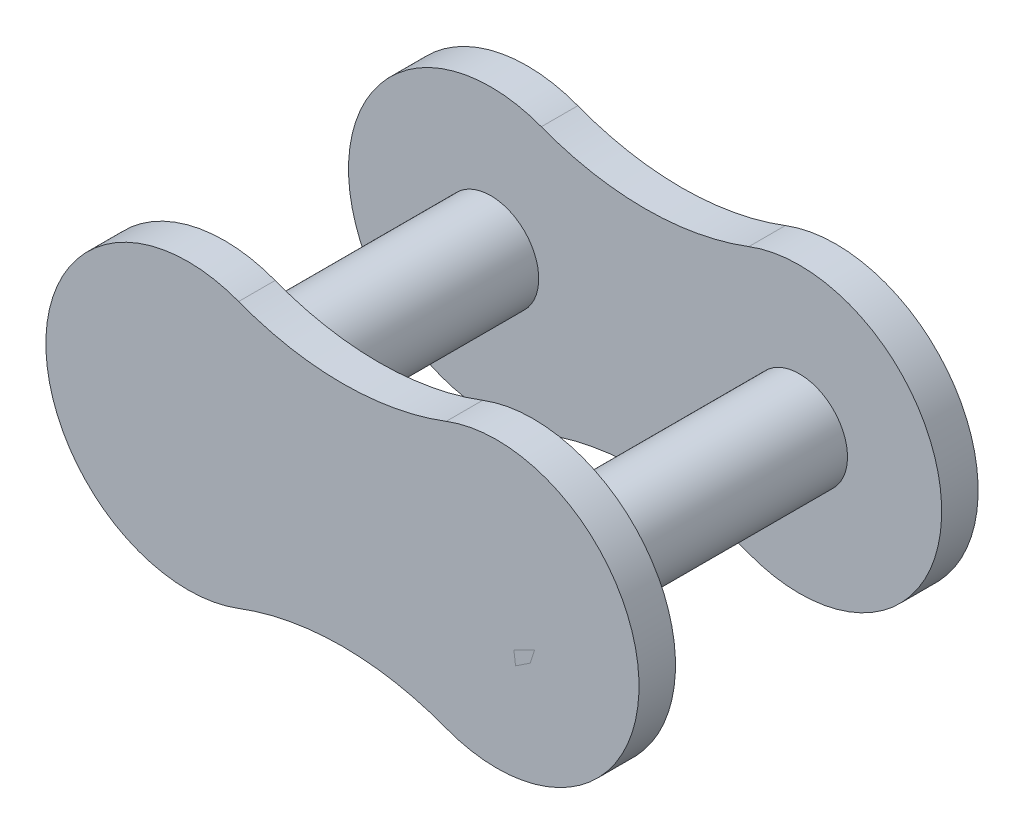
from build123d import *

# Parameters (mm, degrees)
BOSS_EXTRUDE1_DEPTH   = 1.5
SKETCH3_R             = 1.975
BOSS_EXTRUDE2_DEPTH   = 13.95
BOSS_EXTRUDE2_2_DEPTH = 13.95


with BuildPart() as part:
    # Sketch1 → Boss-Extrude1 (new body)
    with BuildSketch(Plane.XY):
        with BuildLine():
            ThreePointArc((2.081092437, 5.467316917), (-5.85, 0), (2.081092437, -5.467316917))
            ThreePointArc((2.081092437, -5.467316917), (6.35, -4.682325977), (10.618907563, -5.467316917))
            ThreePointArc((10.618907563, -5.467316917), (18.55, 0), (10.618907563, 5.467316917))
            ThreePointArc((10.618907563, 5.467316917), (6.35, 4.682325977), (2.081092437, 5.467316917))
        make_face()
    extrude(amount=BOSS_EXTRUDE1_DEPTH)


with BuildPart() as body_2:
    # Mirror2: mirrored copy
    add(part.part.mirror(Plane.XY.offset(6.975)))


with BuildPart() as body_3:
    # Sketch3 → Boss-Extrude2 (new body)
    with BuildSketch(Plane(origin=(0, 0, 0), x_dir=(-1, 0, 0), z_dir=(0, 0, -1))):
        Circle(SKETCH3_R)
    extrude(amount=-BOSS_EXTRUDE2_DEPTH)


with BuildPart() as body_4:
    # Sketch3 → Boss-Extrude2 2 (new body)
    with BuildSketch(Plane(origin=(0, 0, 0), x_dir=(-1, 0, 0), z_dir=(0, 0, -1))):
        with Locations((-12.7, 0)):
            Circle(SKETCH3_R)
    extrude(amount=-BOSS_EXTRUDE2_2_DEPTH)


solid = Compound([part.part, body_2.part, body_3.part, body_4.part])
